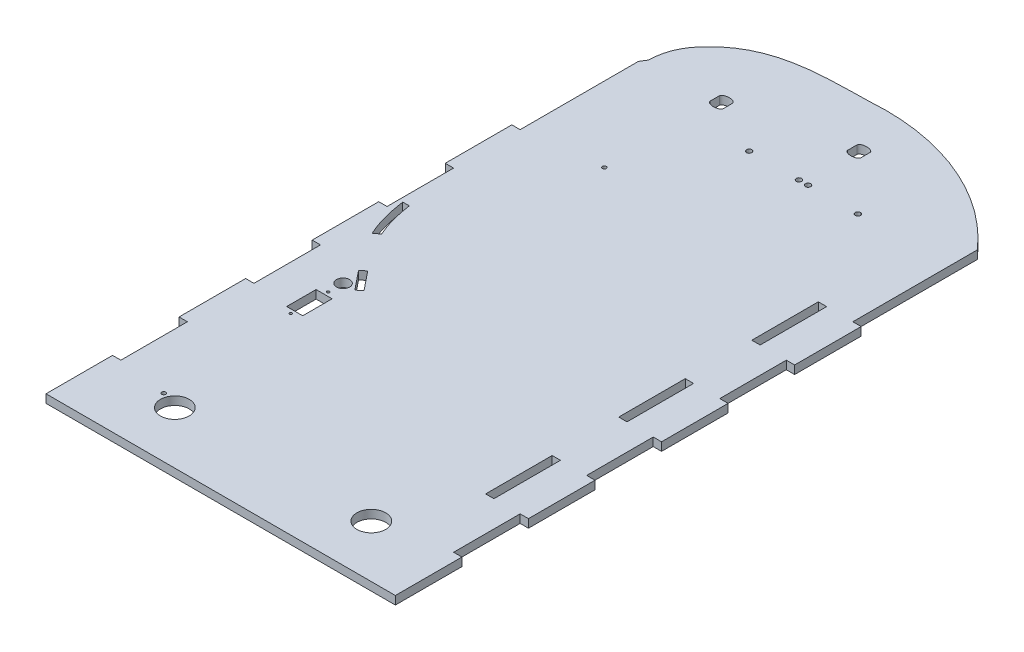
from build123d import *

# Parameters (mm, degrees)
SKETCH2_W           = 254
SKETCH2_H           = 508
SKETCH2_R           = 11
SKETCH2_R_2         = 1.5
SKETCH2_R_3         = 5
SKETCH2_R_4         = 2
SKETCH2_W_2         = 12.25
SKETCH2_H_2         = 22.45
BOSS_EXTRUDE1_DEPTH = 6.35
CUT_EXTRUDE1_REACH  = 569.997
CUT_EXTRUDE2_REACH  = 569.997
SKETCH7_W           = 6.35
SKETCH7_H           = 50.8
BOSS_EXTRUDE2_DEPTH = 6.35
LPATTERN1_COUNT     = 4
LPATTERN1_PITCH     = 101.6
CUT_EXTRUDE3_REACH  = 572.865
SKETCH8_W           = 6.35
SKETCH8_H           = 50.8
LPATTERN2_COUNT     = 3
LPATTERN2_PITCH     = 101.6


with BuildPart() as part:
    # Sketch2 → Boss-Extrude1 (new body)
    with BuildSketch(Plane(origin=(0, 0, 0), x_dir=(1, 0, 0), z_dir=(0, 1, 0))):
        with Locations((127, 254)):
            Rectangle(SKETCH2_W, SKETCH2_H)
        with Locations(Location((52, 40, 0), (0, 0, 270))):
            Circle(SKETCH2_R, mode=Mode.SUBTRACT)
        with Locations(Location((202, 40, 0), (0, 0, 90))):
            Circle(SKETCH2_R, mode=Mode.SUBTRACT)
        with Locations(Location((38.246918035, 45.332917816, 0), (0, 0, 270))):
            Circle(SKETCH2_R_2, mode=Mode.SUBTRACT)
        with Locations(Location((34.015423002, 186.409908658, 0), (0, 0, 270))):
            Circle(SKETCH2_R_3, mode=Mode.SUBTRACT)
        with Locations(Location((57.09109314, 362.75, 0), (0, 0, 270))):
            Circle(SKETCH2_R_2, mode=Mode.SUBTRACT)
        with Locations(Location((184.628948138, 428.795408939, 0), (0, 0, 270))):
            Circle(SKETCH2_R_4, mode=Mode.SUBTRACT)
        with Locations(Location((146.628948138, 428.795408939, 0), (0, 0, 270))):
            Circle(SKETCH2_R_4, mode=Mode.SUBTRACT)
        with Locations(Location((139.628948138, 428.795408939, 0), (0, 0, 270))):
            Circle(SKETCH2_R_4, mode=Mode.SUBTRACT)
        with Locations(Location((101.628948138, 428.795408939, 0), (0, 0, 270))):
            Circle(SKETCH2_R_4, mode=Mode.SUBTRACT)
        with BuildLine():
            Line((3.046441744, 262.929522506), (8.097429065, 262.929522506))
            add(Edge.make_bspline(
                [(8.097429065, 262.929522506), (9.552300843, 252.9110337), (11.964991372, 242.951994092), (16.119595939, 233.68781707)],
                knots=[0, 0, 0, 0, 1, 1, 1, 1], degree=3))
            Line((16.119595939, 233.68781707), (12.017665952, 230.63111289))
            add(Edge.make_bspline(
                [(3.046441744, 262.929522506), (4.60754392, 251.841244803), (7.285656471, 240.828405001), (12.017665952, 230.63111289)],
                knots=[0, 0, 0, 0, 1, 1, 1, 1], degree=3))
        make_face(mode=Mode.SUBTRACT)
        Polygon((31.329859517, 200.915527121), (35.257076266, 204.010194891), (46.889107588, 189.528125605), (42.980562709, 186.409908658), align=None, mode=Mode.SUBTRACT)
        with Locations((33.940423002, 160.784908658)):
            Rectangle(SKETCH2_W_2, SKETCH2_H_2, mode=Mode.SUBTRACT)
        with BuildLine():
            Line((138.65, 474.05), (138.65, 467.05))
            add(Edge.make_bspline(
                [(138.65, 467.05), (138.65, 464.55), (143.65, 464.55), (148.65, 464.55), (148.65, 467.05)],
                knots=[0, 0, 0, 1.570796327, 1.570796327, 3.141592654, 3.141592654, 3.141592654], degree=2, weights=[1, 0.707106781, 1, 0.707106781, 1]))
            Line((148.65, 467.05), (148.65, 474.05))
            add(Edge.make_bspline(
                [(148.65, 474.05), (148.65, 476.55), (143.65, 476.55), (138.65, 476.55), (138.65, 474.05)],
                knots=[3.141592654, 3.141592654, 3.141592654, 4.71238898, 4.71238898, 6.283185307, 6.283185307, 6.283185307], degree=2, weights=[1, 0.707106781, 1, 0.707106781, 1]))
        make_face(mode=Mode.SUBTRACT)
        with BuildLine():
            Line((63.65, 447.05), (63.65, 454.05))
            add(Edge.make_bspline(
                [(63.65, 454.05), (63.65, 456.55), (58.65, 456.55), (53.65, 456.55), (53.65, 454.05)],
                knots=[0, 0, 0, 1.570796327, 1.570796327, 3.141592654, 3.141592654, 3.141592654], degree=2, weights=[1, 0.707106781, 1, 0.707106781, 1]))
            Line((53.65, 454.05), (53.65, 447.05))
            add(Edge.make_bspline(
                [(53.65, 447.05), (53.65, 444.55), (58.65, 444.55), (63.65, 444.55), (63.65, 447.05)],
                knots=[3.141592654, 3.141592654, 3.141592654, 4.71238898, 4.71238898, 6.283185307, 6.283185307, 6.283185307], degree=2, weights=[1, 0.707106781, 1, 0.707106781, 1]))
        make_face(mode=Mode.SUBTRACT)
        with BuildLine():
            ThreePointArc((33.415423002, 175.759908658), (34.015423002, 173.959908658), (34.615423002, 175.759908658))
            ThreePointArc((34.615423002, 175.759908658), (34.015423002, 175.959908658), (33.415423002, 175.759908658))
        make_face(mode=Mode.SUBTRACT)
        with BuildLine():
            ThreePointArc((34.615423002, 145.659908658), (34.015423002, 147.459908658), (33.415423002, 145.659908658))
            ThreePointArc((33.415423002, 145.659908658), (34.015423002, 145.459908658), (34.615423002, 145.659908658))
        make_face(mode=Mode.SUBTRACT)
    extrude(amount=BOSS_EXTRUDE1_DEPTH)

    # Sketch3 → Cut-Extrude1 (cut, up to next)
    with BuildSketch(Plane(origin=(0, 6.35, 0), x_dir=(1, 0, 0), z_dir=(0, 1, 0)), mode=Mode.PRIVATE) as cut_extrude1_sk1:
        with BuildLine():
            Line((254, 508), (127, 508))
            ThreePointArc((127, 508), (196.670138835, 493.003472168), (254, 450.670138835))
            Line((254, 450.670138835), (254, 508))
        make_face()
    cut_extrude1_tool1 = extrude(cut_extrude1_sk1.sketch, amount=-CUT_EXTRUDE1_REACH, mode=Mode.PRIVATE) & part.part
    add(cut_extrude1_tool1.solids().sort_by_distance((223.425214, 6.35, -491.44845))[0], mode=Mode.SUBTRACT)

    # Sketch5 → Cut-Extrude2 (cut, up to next)
    with BuildSketch(Plane(origin=(0, 6.35, 0), x_dir=(1, 0, 0), z_dir=(0, 1, 0)), mode=Mode.PRIVATE) as cut_extrude2_sk1:
        with BuildLine():
            Line((3, 450.670138835), (0, 445.807083784))
            Line((0, 445.807083784), (0, 508))
            Line((0, 508), (0, 526.766169575))
            Line((0, 526.766169575), (127, 526.766169575))
            Line((127, 526.766169575), (127, 508))
            add(Edge.make_bspline(
                [(16.993362097, 481.969152132), (44.771100023, 511.766098677), (91.209279055, 505.856564635), (127, 508)],
                knots=[0, 0, 0, 0, 1, 1, 1, 1], degree=3))
            ThreePointArc((16.993362097, 481.969152132), (6.657603153, 467.812501684), (3, 450.670138835))
        make_face()
    cut_extrude2_tool1 = extrude(cut_extrude2_sk1.sketch, amount=-CUT_EXTRUDE2_REACH, mode=Mode.PRIVATE) & part.part
    add(cut_extrude2_tool1.solids().sort_by_distance((49.030169, 6.35, -509.000401))[0], mode=Mode.SUBTRACT)

    # Sketch7 → Boss-Extrude2 (add)
    with BuildSketch(Plane.XZ):
        with Locations((257.175, -25.4)):
            Rectangle(SKETCH7_W, SKETCH7_H)
        with Locations((-3.175, -25.4)):
            Rectangle(SKETCH7_W, SKETCH7_H)
    boss_extrude2 = extrude(amount=-BOSS_EXTRUDE2_DEPTH)

    # LPattern1: Boss-Extrude2 ×4
    with Locations(*[(0, 0, -i * LPATTERN1_PITCH) for i in range(1, LPATTERN1_COUNT)]):
        add(boss_extrude2)

    # Sketch8 → Cut-Extrude3 (cut, up to next)
    with BuildSketch(Plane(origin=(0, 6.35, 0), x_dir=(1, 0, 0), z_dir=(0, 1, 0)), mode=Mode.PRIVATE) as cut_extrude3_sk1:
        with Locations((230.825, 127)):
            Rectangle(SKETCH8_W, SKETCH8_H)
    cut_extrude3_tool1 = extrude(cut_extrude3_sk1.sketch, amount=-CUT_EXTRUDE3_REACH, mode=Mode.PRIVATE) & part.part
    cut_extrude3 = cut_extrude3_tool1.solids().sort_by_distance((230.825, 6.35, -127))[0]
    add(cut_extrude3, mode=Mode.SUBTRACT)

    # LPattern2: Cut-Extrude3 ×3
    with Locations(*[(0, 0, -i * LPATTERN2_PITCH) for i in range(1, LPATTERN2_COUNT)]):
        add(cut_extrude3, mode=Mode.SUBTRACT)


solid = part.part
